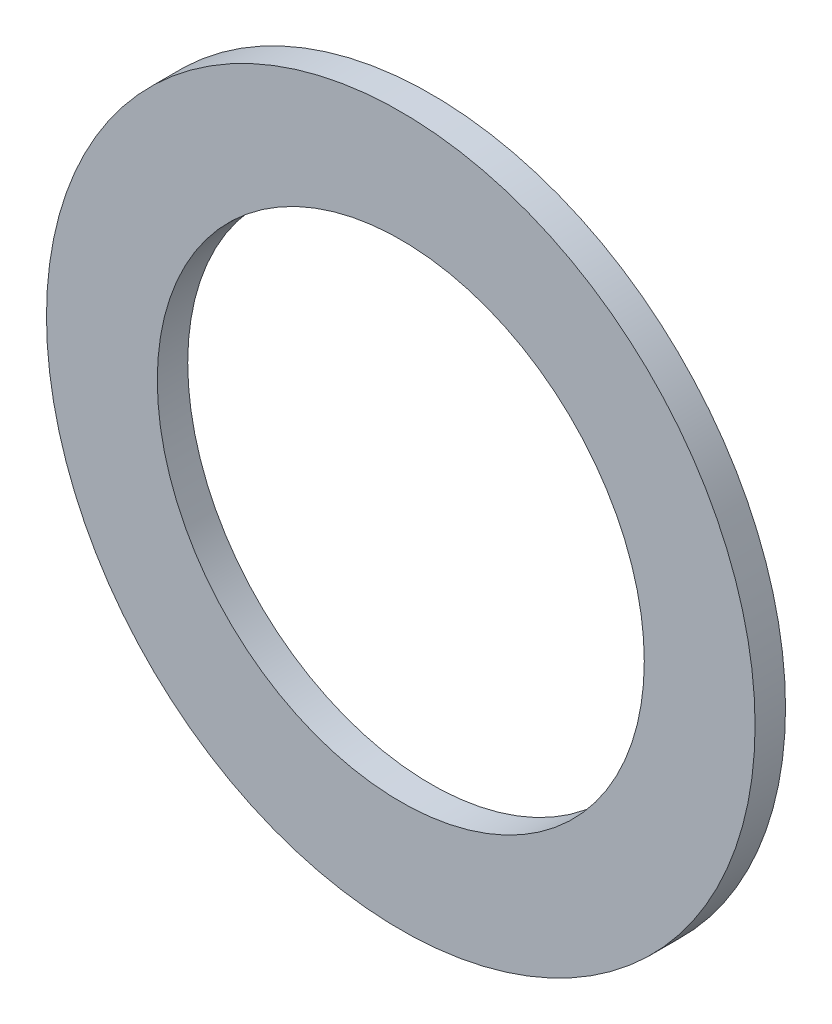
from build123d import *

# Parameters (mm, degrees)
ESQUISSE1_R        = 73.914
ESQUISSE1_R_2      = 50.8
BOSS_EXTRU_1_DEPTH = 6.35


with BuildPart() as part:
    # Esquisse1 → Boss.-Extru.1 (new body)
    with BuildSketch(Plane.XY):
        Circle(ESQUISSE1_R)
        Circle(ESQUISSE1_R_2, mode=Mode.SUBTRACT)
    extrude(amount=BOSS_EXTRU_1_DEPTH)


solid = part.part
